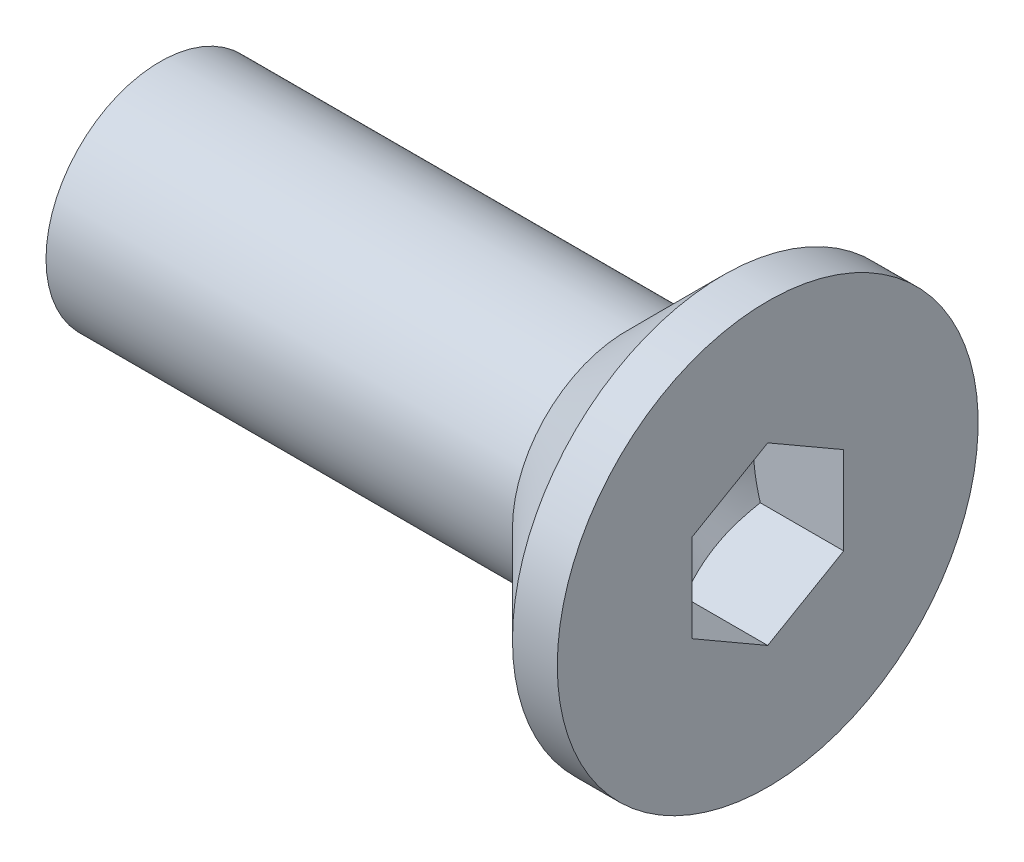
from build123d import *

# Parameters (mm, degrees)
SLOT_REACH = 11.649


with BuildPart() as part:
    # Sk1 → Body (revolve)
    with BuildSketch(Plane.XY, mode=Mode.PRIVATE) as body_sk:
        Polygon((-6.14, 0), (1.86, 0), (1.86, 2.77), (1.27, 2.77), (0, 1.5), (-6.14, 1.5), align=None)
    revolve(body_sk.sketch.rotate(Axis((0, 0, 0), (1, 0, 0)), 90), axis=Axis((0, 0, 0), (1, 0, 0)))

    # Slot: up to this cone (the profile starts inside it)
    slot_end = Plane(origin=(1.86, 0, 0), z_dir=(1, 0, 0)).offset(-1.764817835) * Cone(1.732e-06, 29.393897654, 16.970573723, align=(Align.CENTER, Align.CENTER, Align.MIN), mode=Mode.PRIVATE)
    # Sk2 → Slot (cut, up to the surface)
    with BuildSketch(Plane(origin=(1.86, 0, -1.86), x_dir=(0, 0, 1), z_dir=(-1, 0, 0)), mode=Mode.PRIVATE) as slot_sk1:
        Polygon((1.86, 1.154700538), (0.86, 0.577350269), (0.86, -0.577350269), (1.86, -1.154700538), (2.86, -0.577350269), (2.86, 0.577350269), align=None)
    slot_tool1 = extrude(slot_sk1.sketch, amount=SLOT_REACH, mode=Mode.PRIVATE) & slot_end
    add(slot_tool1.solids().sort_by_distance((1.86, 0, 0))[0], mode=Mode.SUBTRACT)


solid = part.part
